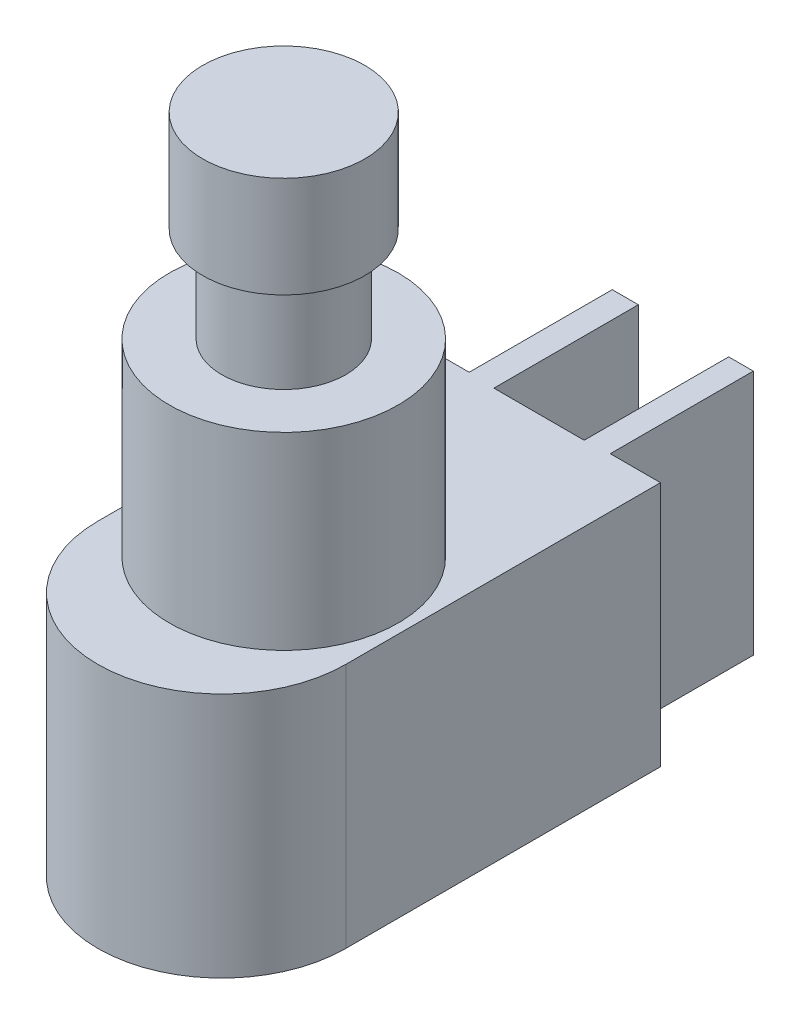
from build123d import *

# Parameters (mm, degrees)
SKETCH_1_R            = 6
EXTRUDE_1_DEPTH       = 9.9
SKETCH_2_R            = 4.25
EXTRUDE_2_DEPTH       = 10.3
SKETCH_2_2_R          = 4.25
SKETCH_2_2_R_2        = 3.25
CUT_EXTRUDE_1_DEPTH   = 5
EXTRUDE_3_DEPTH       = 12.9
SKETCH_4_W            = 4.733909146
SKETCH_4_H            = 7.574967903
CUT_EXTRUDE_1_2_DEPTH = 12.9


with BuildPart() as part:
    # 草图1 → 凸台-拉伸1 (new body)
    with BuildSketch(Plane(origin=(0, 0, 0), x_dir=(1, 0, 0), z_dir=(0, 1, 0))):
        Circle(SKETCH_1_R)
    extrude(amount=EXTRUDE_1_DEPTH)

    # 草图2 → 凸台-拉伸2 (add)
    with BuildSketch(Plane(origin=(0, 9.9, 0), x_dir=(1, 0, 0), z_dir=(0, 1, 0))):
        Circle(SKETCH_2_R)
    extrude(amount=EXTRUDE_2_DEPTH)

    # 草图2<2> → Cut-Extrude 1 (cut)
    with BuildSketch(Plane(origin=(0, 9.9, 0), x_dir=(1, 0, 0), z_dir=(0, 1, 0))):
        Circle(SKETCH_2_2_R)
        Circle(SKETCH_2_2_R_2, mode=Mode.SUBTRACT)
    extrude(amount=CUT_EXTRUDE_1_DEPTH, mode=Mode.SUBTRACT)

    # 草图3 → 凸台-拉伸3 (add)
    with BuildSketch(Plane.XZ):
        with BuildLine():
            Line((6.5, -13.25), (6.5, 3.25))
            ThreePointArc((6.5, 3.25), (0, 9.75), (-6.5, 3.25))
            Line((-6.5, 3.25), (-6.5, -13.25))
            Line((-6.5, -13.25), (-3.527984912, -13.25))
            Line((-3.527984912, -13.25), (-3.527984912, -20.75))
            Line((-3.527984912, -20.75), (3.868172302, -20.75))
            Line((3.868172302, -20.75), (3.868172302, -13.25))
            Line((3.868172302, -13.25), (6.5, -13.25))
        make_face()
    extrude(amount=EXTRUDE_3_DEPTH)

    # 草图4 → Cut-Extrude 1 2 (cut)
    with BuildSketch(Plane(origin=(0, 0, 0), x_dir=(1, 0, 0), z_dir=(0, 1, 0))):
        with Locations((0.208089462, 16.962516048)):
            Rectangle(SKETCH_4_W, SKETCH_4_H)
    extrude(amount=-CUT_EXTRUDE_1_2_DEPTH, mode=Mode.SUBTRACT)


solid = part.part
